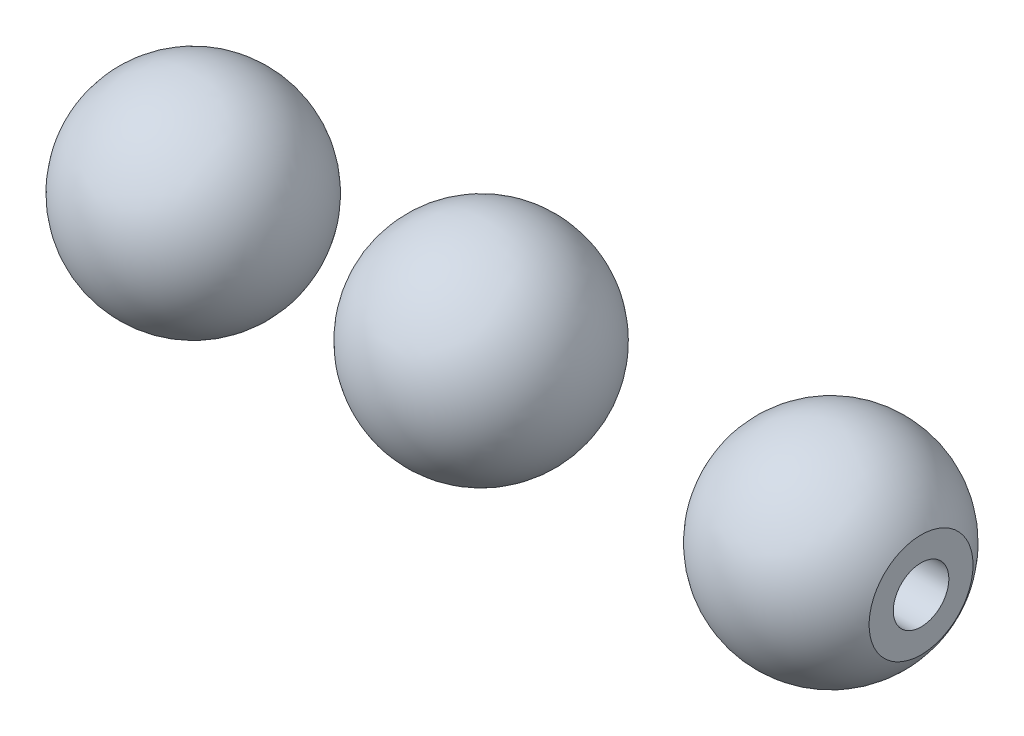
from build123d import *


with BuildPart() as part:
    # Sketch6 → Revolve7 (revolve)
    with BuildSketch(Plane(origin=(0, 0, 0), x_dir=(0, 0, -1), z_dir=(1, 0, 0))):
        with BuildLine():
            Line((19.5, 0), (-22.5, 0))
            ThreePointArc((-22.5, 0), (-5.809475019, -21.737065119), (19.5, -11.22497216))
            Line((19.5, -11.22497216), (19.5, 0))
        make_face()
    revolve(axis=Axis((0, 0, -19.5), (0, 0, 1)))

    # Sketch14 → CSK for M10 Flat Head Machine Screw1 (revolve, cut)
    with BuildSketch(Plane(origin=(0, 0, -19.5), x_dir=(0, 1, 0), z_dir=(1, 0, 0))):
        Polygon((0, 0), (0, 37.605163714), (6, 34), (6, 4), (10, 0), align=None)
    revolve(axis=Axis((0, 0, -25.85), (0, 0, 1)), mode=Mode.SUBTRACT)


with BuildPart() as body_2:
    # Sketch8 → Revolve8 (revolve)
    with BuildSketch(Plane.XY):
        with BuildLine():
            Line((-81.674659539, -3.491056559), (-39.674659539, -3.491056559))
            ThreePointArc((-39.674659539, -3.491056559), (-56.36518452, 18.246008561), (-81.674659539, 7.733915602))
            Line((-81.674659539, 7.733915602), (-81.674659539, -3.491056559))
        make_face()
    revolve(axis=Axis((-81.674659539, -3.491056559, 0), (1, 0, 0)))

    # Sketch12 → CBORE for M12 Hex Head Bolt1 (revolve, cut)
    with BuildSketch(Plane(origin=(-81.674659539, -3.491056559, 0), x_dir=(0, 0, 1), z_dir=(0, 1, 0))):
        Polygon((0, 0), (0, 35.605163714), (6, 32), (6, 8), (10, 8), (10, 0), align=None)
    revolve(axis=Axis((-88.024659539, -3.491056559, 0), (1, 0, 0)), mode=Mode.SUBTRACT)


with BuildPart() as body_3:
    # Sketch9 → Revolve9 (revolve)
    with BuildSketch(Plane.XY):
        with BuildLine():
            Line((95.024103541, 0), (53.024103541, 0))
            ThreePointArc((53.024103541, 0), (69.714628521, -21.737065119), (95.024103541, -11.22497216))
            Line((95.024103541, -11.22497216), (95.024103541, 0))
        make_face()
    revolve(axis=Axis((95.024103541, 0, 0), (-1, 0, 0)))

    # Sketch16 → M12 Clearance Hole1 (revolve, cut)
    with BuildSketch(Plane(origin=(95.024103541, 0, 0), x_dir=(0, 0, -1), z_dir=(0, 1, 0))):
        Polygon((0, 0), (0, 37.605163714), (6, 34), (6, 0), align=None)
    revolve(axis=Axis((101.374103541, 0, 0), (-1, 0, 0)), mode=Mode.SUBTRACT)


solid = Compound([part.part, body_2.part, body_3.part])
